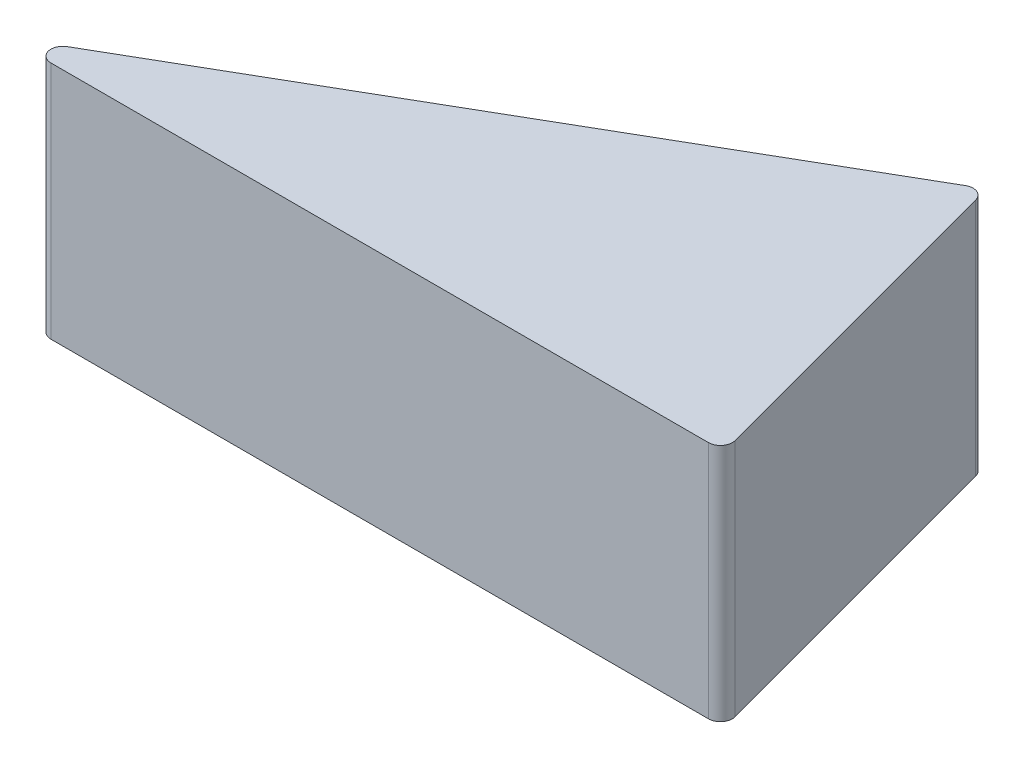
from build123d import *

# Parameters (mm, degrees)
BOSS_EXTRUDE1_DEPTH = 10
FILLET1_R           = 0.5


with BuildPart() as part:
    # Sketch1 → Boss-Extrude1 (new body)
    with BuildSketch(Plane(origin=(0, 0, 0), x_dir=(1, 0, 0), z_dir=(0, 1, 0))):
        Polygon((0, 0), (30, 0), (25.980762114, 15), align=None)
    extrude(amount=BOSS_EXTRUDE1_DEPTH)

    # Fillet1
    fillet1_edges = [part.edges().sort_by_distance(p)[0] for p in [
        (30, 5, 0),
        (0, 5, 0),
        (25.980762114, 5, -15),
    ]]
    fillet(fillet1_edges, radius=FILLET1_R)


solid = part.part
